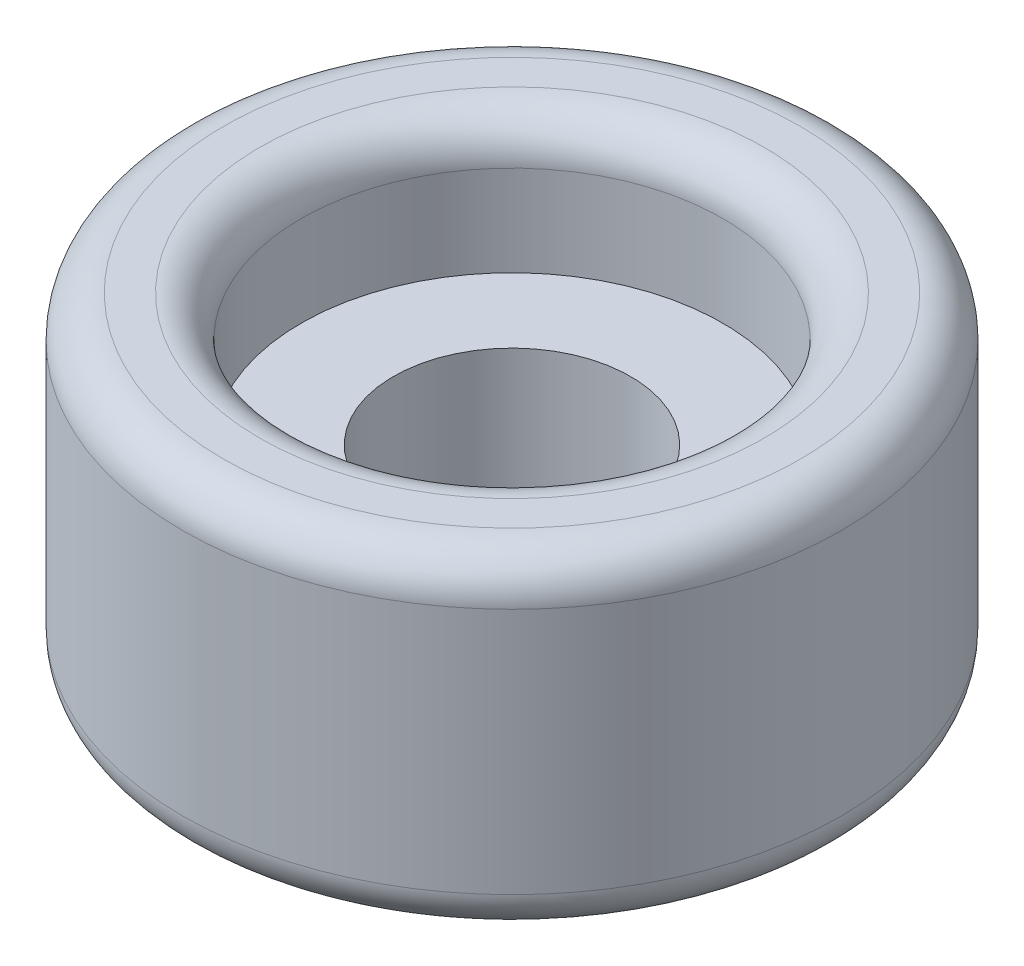
from build123d import *

# Parameters (mm, degrees)
SKETCH1_R           = 6.35
BOSS_EXTRUDE1_DEPTH = 6.35
SKETCH2_R           = 2.286
CUT_EXTRUDE1_DEPTH  = 11.998522628
SKETCH3_R           = 4.064
CUT_EXTRUDE2_DEPTH  = 2.54
FILLET1_R           = 0.79375


with BuildPart() as part:
    # Sketch1 → Boss-Extrude1 (new body)
    with BuildSketch(Plane(origin=(0, 0, 0), x_dir=(1, 0, 0), z_dir=(0, 1, 0))):
        with Locations(Location((0, 0, 0), (0, 0, 270))):
            Circle(SKETCH1_R)
    extrude(amount=BOSS_EXTRUDE1_DEPTH)

    # Sketch2 → Cut-Extrude1 (cut, through all)
    with BuildSketch(Plane(origin=(0, 6.35, 0), x_dir=(1, 0, 0), z_dir=(0, 1, 0))):
        with Locations(Location((0, 0, 0), (0, 0, 270))):
            Circle(SKETCH2_R)
    extrude(amount=-CUT_EXTRUDE1_DEPTH, mode=Mode.SUBTRACT)

    # Sketch3 → Cut-Extrude2 (cut)
    with BuildSketch(Plane(origin=(0, 6.35, 0), x_dir=(1, 0, 0), z_dir=(0, 1, 0))):
        with Locations(Location((0, 0, 0), (0, 0, 270))):
            Circle(SKETCH3_R)
    extrude(amount=-CUT_EXTRUDE2_DEPTH, mode=Mode.SUBTRACT)

    # Fillet1
    fillet1_edges = [part.edges().sort_by_distance(p)[0] for p in [
        (0, 6.35, -4.064),
        (0, 0, -6.35),
        (0, 6.35, -6.35),
    ]]
    fillet(fillet1_edges, radius=FILLET1_R)


solid = part.part
